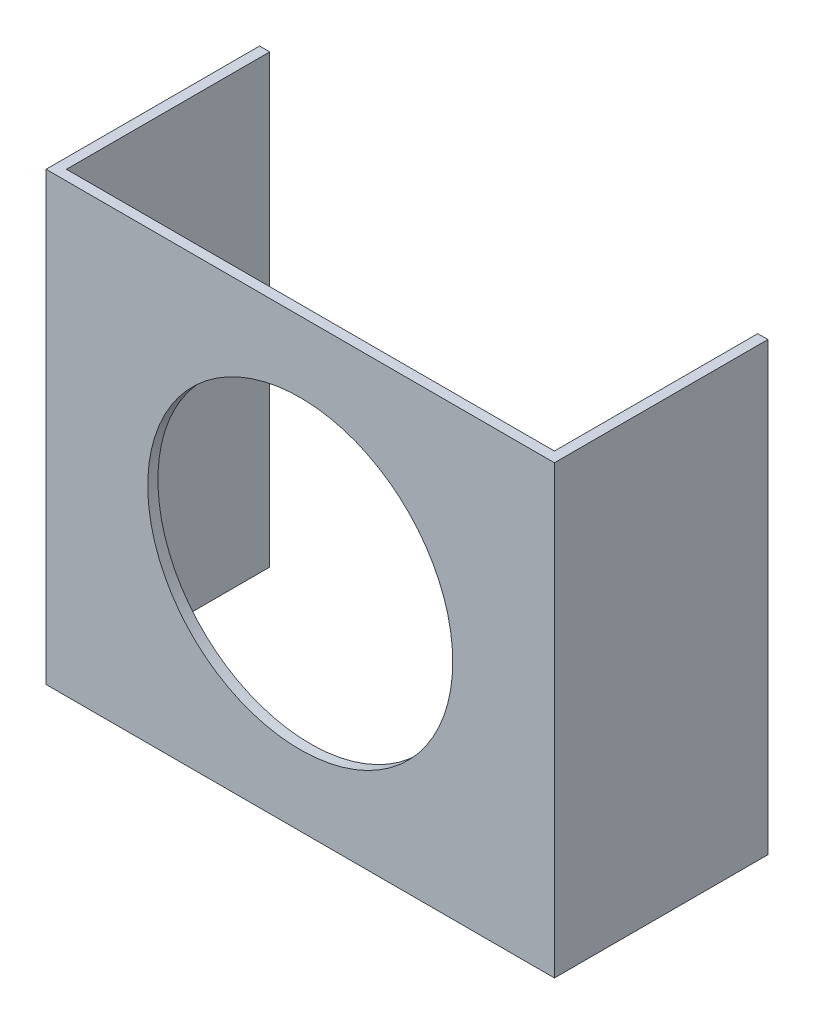
from build123d import *

# Parameters (mm, degrees)
SKETCH1_W           = 50.000000596
SKETCH1_H           = 43.88833532
BOSS_EXTRUDE1_DEPTH = 1
SKETCH2_W           = 1
SKETCH2_H           = 43.88833532
BOSS_EXTRUDE3_DEPTH = 20
SKETCH3_R           = 15
CUT_EXTRUDE1_DEPTH  = 40.338867665


with BuildPart() as part:
    # Sketch1 → Boss-Extrude1 (new body)
    with BuildSketch(Plane.XY):
        Rectangle(SKETCH1_W, SKETCH1_H)
    extrude(amount=BOSS_EXTRUDE1_DEPTH)

    # Sketch2 → Boss-Extrude3 (add)
    with BuildSketch(Plane(origin=(0, 0, 0), x_dir=(-1, 0, 0), z_dir=(0, 0, -1))):
        Polygon((25.000000298, 21.94416766), (24.000000298, 21.94416766), (24.000000298, -21.94416766), (25.000000298, -21.94416766), (25.000000298, 21.001254621), align=None)
        with Locations((-24.500000298, 0)):
            Rectangle(SKETCH2_W, SKETCH2_H)
    extrude(amount=BOSS_EXTRUDE3_DEPTH)

    # Sketch3 → Cut-Extrude1 (cut, through all)
    with BuildSketch(Plane.XY.offset(1)):
        Circle(SKETCH3_R)
    extrude(amount=-CUT_EXTRUDE1_DEPTH, mode=Mode.SUBTRACT)


solid = part.part
